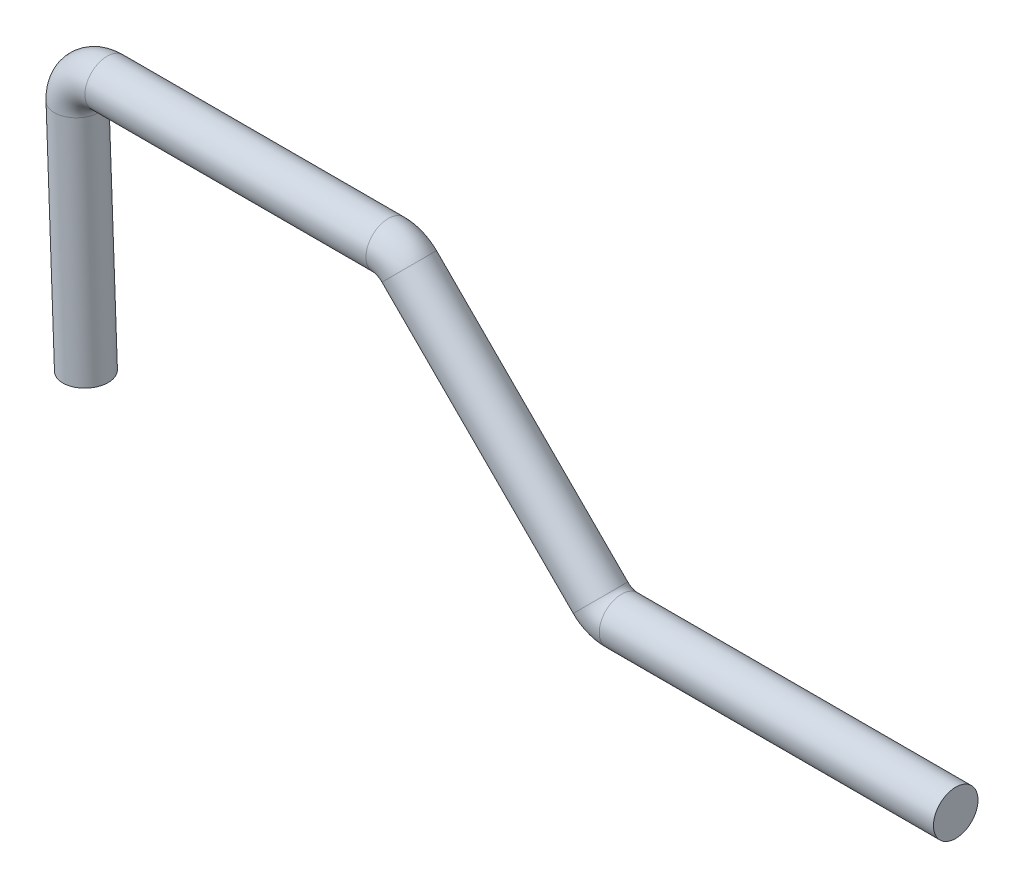
from build123d import *

# Parameters (mm, degrees)
SKETCH1_R = 7.5


with BuildPart() as part:
    # Sweep3: sweep along a curve in space
    with BuildLine() as sweep3_path:
        Line((0, 0, 0), (-112.552079249, 0, 0))
        ThreePointArc((-112.552079249, 0, 0), (-116.378913573, 0.761204675, 0), (-119.623147061, 2.928932188, 0))
        Line((-119.623147061, 2.928932188, 0), (-184.039505872, 67.345290999, 0))
        ThreePointArc((-184.039505872, 67.345290999, 0), (-187.28373936, 69.513018512, 0), (-191.110573684, 70.274223187, 0))
        Line((-191.110573684, 70.274223187, 0), (-285.776779589, 70.274223187, 0))
        ThreePointArc((-285.776779589, 70.274223187, 0), (-292.977279683, 67.213444929, 0), (-295.769952951, 59.904782865, 0))
        Line((-295.769952951, 59.904782865, 0), (-292.90806011, -17.507967024, 0))
    # Sketch1 → Sweep3 (sweep)
    with BuildSketch(Plane(origin=(0, 0, 0), x_dir=(0, 0, -1), z_dir=(1, 0, 0))):
        Circle(SKETCH1_R)
    sweep(path=sweep3_path.line)


solid = part.part
